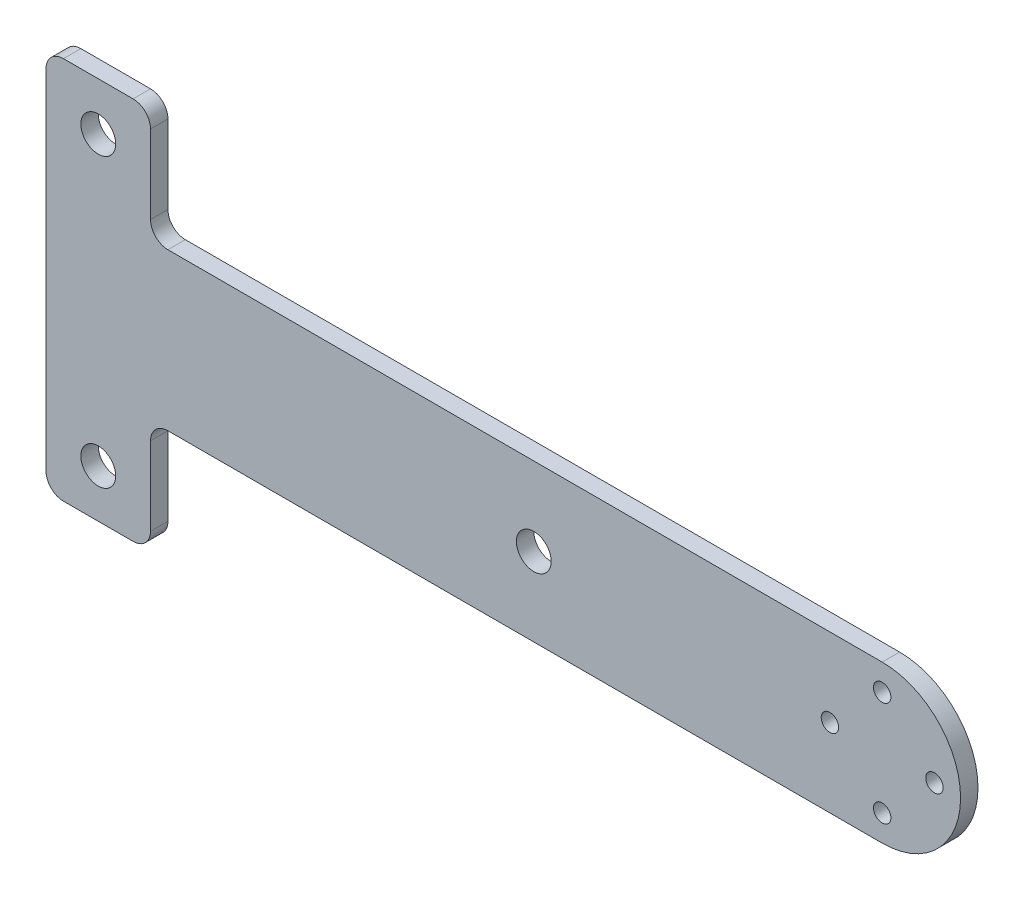
from build123d import *

# Parameters (mm, degrees)
SKETCH_1_R      = 2
SKETCH_1_R_2    = 1
EXTRUDE_1_DEPTH = 2
FILLET_1_R      = 2


with BuildPart() as part:
    # 草图1 → 凸台-拉伸1 (new body)
    with BuildSketch(Plane.XY):
        with BuildLine():
            Line((41.276428571, -8.854285714), (-42.723571429, -8.854285714))
            Line((-42.723571429, -8.854285714), (-42.723571429, -21.854285714))
            Line((-42.723571429, -21.854285714), (-54.723571429, -21.854285714))
            Line((-54.723571429, -21.854285714), (-54.723571429, 22.145714286))
            Line((-54.723571429, 22.145714286), (-42.723571429, 22.145714286))
            Line((-42.723571429, 22.145714286), (-42.723571429, 9.145714286))
            Line((-42.723571429, 9.145714286), (41.276428571, 9.145714286))
            ThreePointArc((41.276428571, 9.145714286), (50.276428571, 0.145714286), (41.276428571, -8.854285714))
        make_face()
        with Locations((1.276428571, 0.145714286)):
            Circle(SKETCH_1_R, mode=Mode.SUBTRACT)
        with Locations((-48.723571429, 16.645714286)):
            Circle(SKETCH_1_R, mode=Mode.SUBTRACT)
        with Locations((-48.723571429, -16.354285714)):
            Circle(SKETCH_1_R, mode=Mode.SUBTRACT)
        with Locations((41.276428571, 6.145714286)):
            Circle(SKETCH_1_R_2, mode=Mode.SUBTRACT)
        with Locations((47.276428571, 0.145714286)):
            Circle(SKETCH_1_R_2, mode=Mode.SUBTRACT)
        with Locations((41.276428571, -5.854285714)):
            Circle(SKETCH_1_R_2, mode=Mode.SUBTRACT)
        with Locations((35.276428571, 0.145714286)):
            Circle(SKETCH_1_R_2, mode=Mode.SUBTRACT)
    extrude(amount=EXTRUDE_1_DEPTH)

    # 圆角1
    fillet_1_edges = [part.edges().sort_by_distance(p)[0] for p in [
        (-42.723571429, -8.854285714, 1),
        (-42.723571429, -21.854285714, 1),
        (-54.723571429, -21.854285714, 1),
        (-54.723571429, 22.145714286, 1),
        (-42.723571429, 22.145714286, 1),
        (-42.723571429, 9.145714286, 1),
    ]]
    fillet(fillet_1_edges, radius=FILLET_1_R)


solid = part.part
